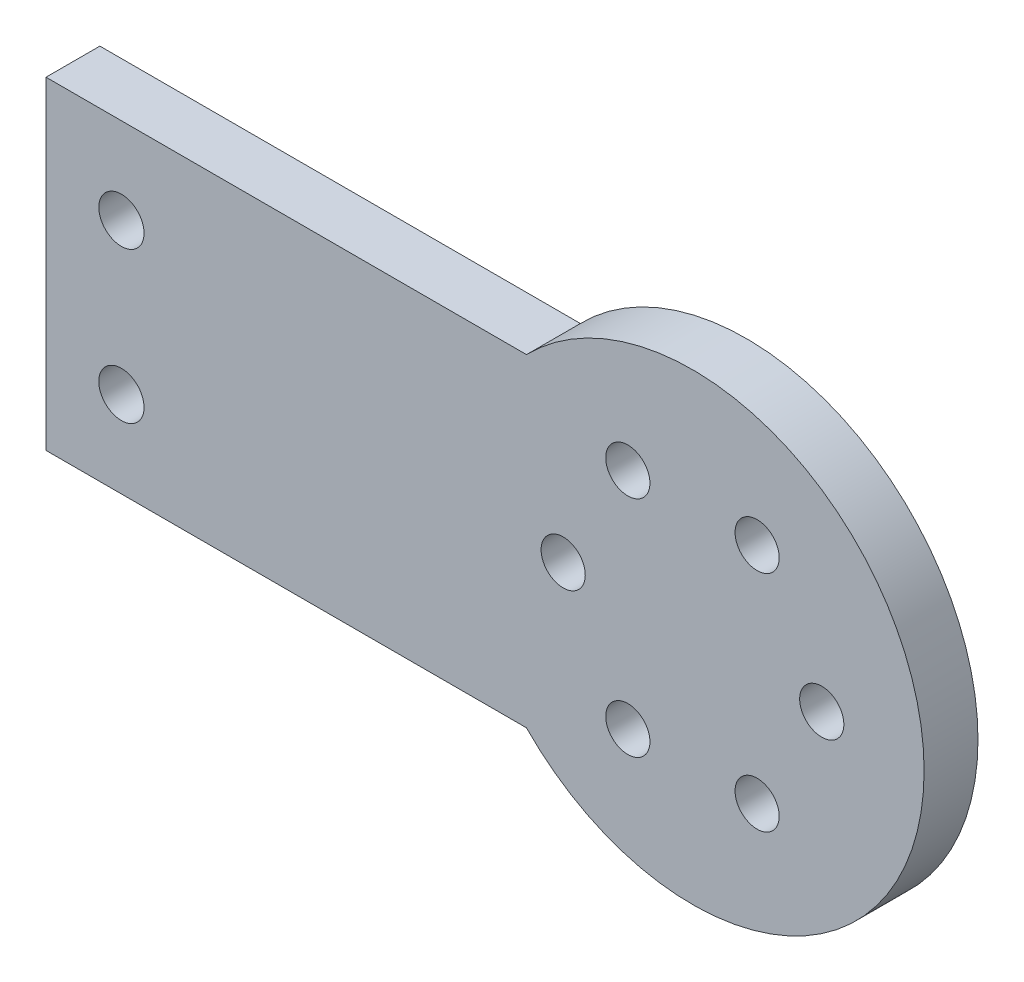
from build123d import *

# Parameters (mm, degrees)
SKETCH_1_R          = 2.05
EXTRUDE_1_DEPTH     = 5
SKETCH_2_R          = 2.1
CUT_EXTRUDE_1_DEPTH = 64.931604078


with BuildPart() as part:
    # 草图1 → 凸台-拉伸1 (new body)
    with BuildSketch(Plane.XY):
        with BuildLine():
            Line((-60, 0), (-60, 15))
            Line((-60, 15), (-15.402921801, 15))
            ThreePointArc((-15.402921801, 15), (21.5, 0), (-15.402921801, -15))
            Line((-15.402921801, -15), (-60, -15))
            Line((-60, -15), (-60, 0))
        make_face()
        with Locations((12, 0)):
            Circle(SKETCH_1_R, mode=Mode.SUBTRACT)
        with Locations((6, -10.392304845)):
            Circle(SKETCH_1_R, mode=Mode.SUBTRACT)
        with Locations((-6, -10.392304845)):
            Circle(SKETCH_1_R, mode=Mode.SUBTRACT)
        with Locations((-12, 0)):
            Circle(SKETCH_1_R, mode=Mode.SUBTRACT)
        with Locations((-6, 10.392304845)):
            Circle(SKETCH_1_R, mode=Mode.SUBTRACT)
        with Locations((6, 10.392304845)):
            Circle(SKETCH_1_R, mode=Mode.SUBTRACT)
    extrude(amount=EXTRUDE_1_DEPTH)

    # 草图2 → 切除-拉伸1 (cut, through all)
    with BuildSketch(Plane.XY.offset(5)):
        with Locations((-53, 7)):
            Circle(SKETCH_2_R)
        with Locations((-53, -7)):
            Circle(SKETCH_2_R)
    extrude(amount=-CUT_EXTRUDE_1_DEPTH, mode=Mode.SUBTRACT)


solid = part.part
